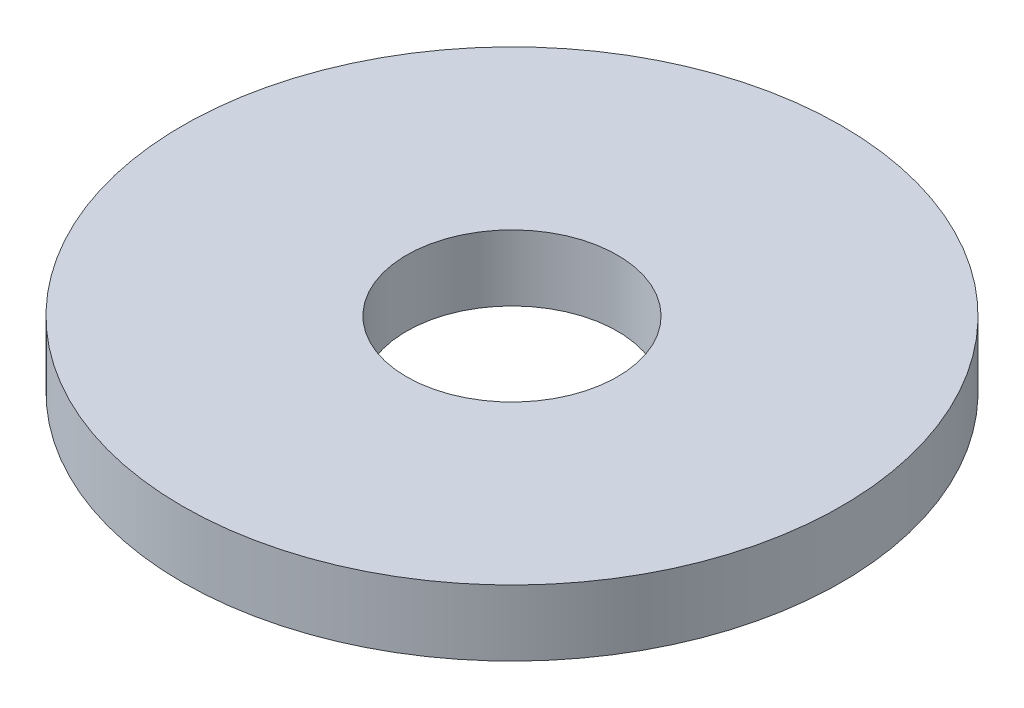
from build123d import *

# Parameters (mm, degrees)
SKETCH1_R           = 5
SKETCH1_R_2         = 1.6
BOSS_EXTRUDE1_DEPTH = 1


with BuildPart() as part:
    # Sketch1 → Boss-Extrude1 (new body)
    with BuildSketch(Plane(origin=(0, 0, 0), x_dir=(1, 0, 0), z_dir=(0, 1, 0))):
        with Locations(Location((0, 0, 0), (0, 0, 270))):
            Circle(SKETCH1_R)
        with Locations(Location((0, 0, 0), (0, 0, 270))):
            Circle(SKETCH1_R_2, mode=Mode.SUBTRACT)
    extrude(amount=BOSS_EXTRUDE1_DEPTH)


solid = part.part
